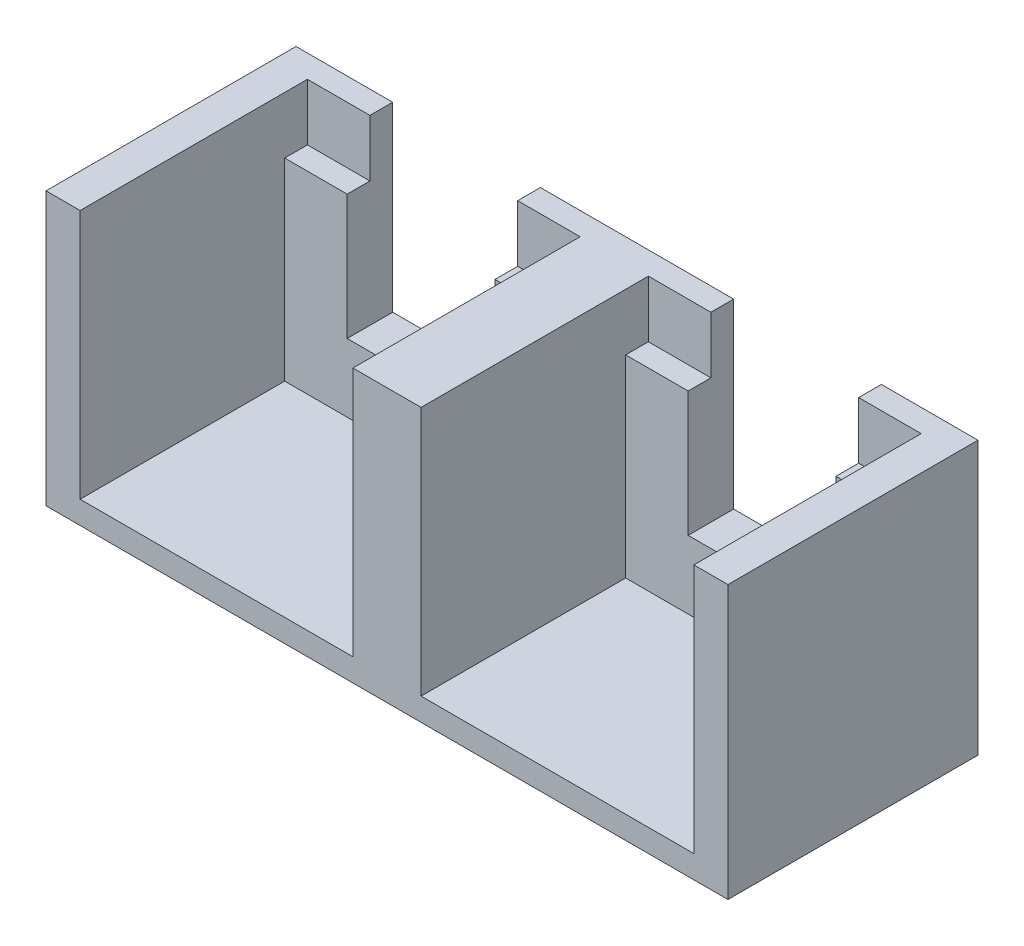
from build123d import *

# Parameters (mm, degrees)
SKETCH_1_W          = 60
SKETCH_1_H          = 24
EXTRUDE_1_DEPTH     = 22
SKETCH_3_W          = 24
SKETCH_3_H          = 20
CUT_EXTRUDE_2_DEPTH = 18
SKETCH_5_W          = 13
SKETCH_5_H          = 16
CUT_EXTRUDE_4_DEPTH = 4
SKETCH_6_W          = 24
SKETCH_6_H          = 20
CUT_EXTRUDE_5_DEPTH = 5


with BuildPart() as part:
    # ｽｹｯﾁ1 → ﾎﾞｽ - 押し出し1 (new body)
    with BuildSketch(Plane.XY):
        Rectangle(SKETCH_1_W, SKETCH_1_H)
    extrude(amount=EXTRUDE_1_DEPTH)

    # ｽｹｯﾁ3 → ｶｯﾄ - 押し出し2 (cut)
    with BuildSketch(Plane.XY.offset(22)):
        with Locations((-15, 0)):
            Rectangle(SKETCH_3_W, SKETCH_3_H)
    cut_extrude_2 = extrude(amount=-CUT_EXTRUDE_2_DEPTH, mode=Mode.SUBTRACT)

    # ｽｹｯﾁ5 → ｶｯﾄ - 押し出し4 (cut)
    with BuildSketch(Plane.XY.offset(4)):
        with Locations((-15, 4)):
            Rectangle(SKETCH_5_W, SKETCH_5_H)
    cut_extrude_4 = extrude(amount=-CUT_EXTRUDE_4_DEPTH, mode=Mode.SUBTRACT)

    # ｽｹｯﾁ6 → ｶｯﾄ - 押し出し5 (cut)
    with BuildSketch(Plane(origin=(0, 12, 0), x_dir=(1, 0, 0), z_dir=(0, 1, 0))):
        with Locations((-15, -12)):
            Rectangle(SKETCH_6_W, SKETCH_6_H)
    cut_extrude_5 = extrude(amount=-CUT_EXTRUDE_5_DEPTH, mode=Mode.SUBTRACT)

    # ﾐﾗｰ1: ｶｯﾄ - 押し出し2, ｶｯﾄ - 押し出し4, ｶｯﾄ - 押し出し5 across plane
    add(cut_extrude_2.mirror(Plane(origin=(0, 0, 0), x_dir=(0, 0, 1), z_dir=(1, 0, 0))), mode=Mode.SUBTRACT)
    add(cut_extrude_4.mirror(Plane(origin=(0, 0, 0), x_dir=(0, 0, 1), z_dir=(1, 0, 0))), mode=Mode.SUBTRACT)
    add(cut_extrude_5.mirror(Plane(origin=(0, 0, 0), x_dir=(0, 0, 1), z_dir=(1, 0, 0))), mode=Mode.SUBTRACT)


solid = part.part
